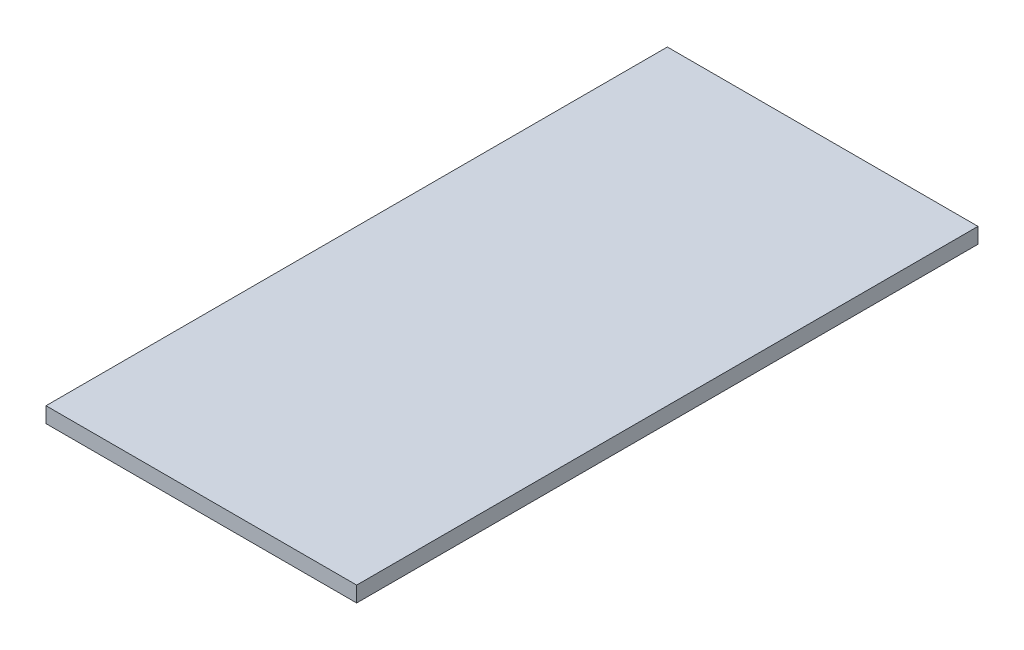
from build123d import *

# Parameters (mm, degrees)
SKETCH1_W           = 50.8
SKETCH1_H           = 101.6
BOSS_EXTRUDE1_DEPTH = 2.54


with BuildPart() as part:
    # Sketch1 → Boss-Extrude1 (new body)
    with BuildSketch(Plane(origin=(0, 0, 0), x_dir=(1, 0, 0), z_dir=(0, 1, 0))):
        with Locations((25.4, 50.8)):
            Rectangle(SKETCH1_W, SKETCH1_H)
    extrude(amount=BOSS_EXTRUDE1_DEPTH)


solid = part.part
